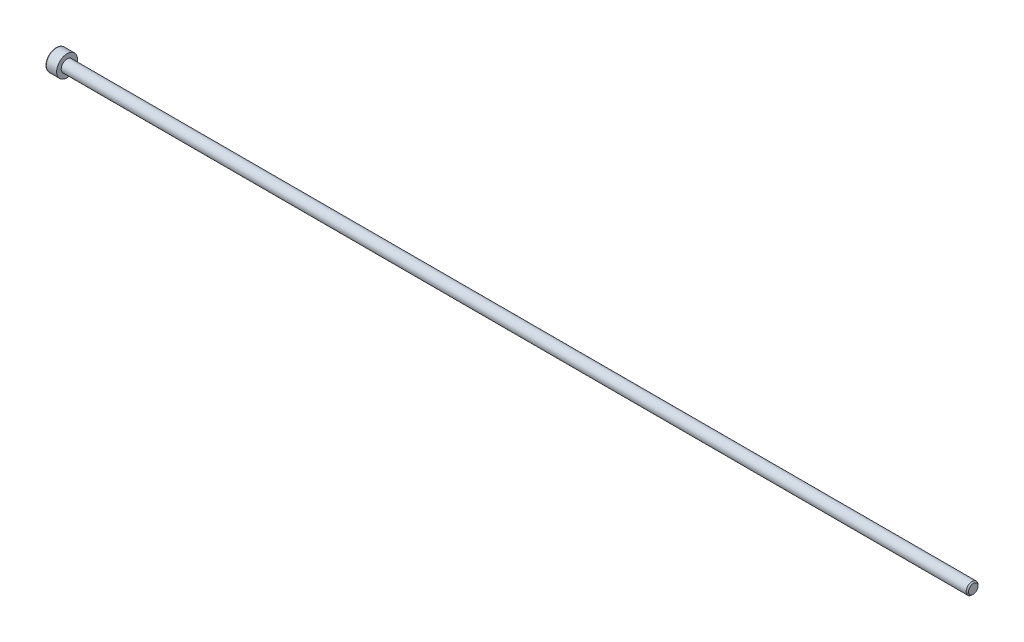
from build123d import *

# Parameters (mm, degrees)
CUT_EXTRUDE1_DEPTH = 1.3
FILLET1_R          = 0.266
CHAMFER2_SIZE      = 0.3065


with BuildPart() as part:
    # Sketch1 → Revolve1 (revolve)
    with BuildSketch(Plane(origin=(0, 0, 0), x_dir=(-1, 0, 0), z_dir=(0, 0, -1)), mode=Mode.PRIVATE) as revolve1_sk:
        Polygon((0, 0), (2.86, 0), (2.86, 2.66), (0, 2.66), (0, 1.5), (-230, 1.5), (-230, 0), align=None)
    revolve(revolve1_sk.sketch.rotate(Axis((0, 0, 0), (-1, 0, 0)), 180), axis=Axis((0, 0, 0), (-1, 0, 0)))

    # Sketch2 → Cut-Extrude1 (cut)
    with BuildSketch(Plane.ZY.offset(2.86)):
        Polygon((-1.25, -0.721687836), (0, -1.443375673), (1.25, -0.721687836), (1.25, 0.721687836), (0, 1.443375673), (-1.25, 0.721687836), align=None)
    extrude(amount=-CUT_EXTRUDE1_DEPTH, mode=Mode.SUBTRACT)

    # Fillet1
    fillet1_edges = [part.edges().sort_by_distance(p)[0] for p in [
        (-2.86, 2.66, 0),
    ]]
    fillet(fillet1_edges, radius=FILLET1_R)

    # Chamfer2
    chamfer2_edges = [part.edges().sort_by_distance(p)[0] for p in [
        (230, 1.5, 0),
    ]]
    chamfer(chamfer2_edges, length=CHAMFER2_SIZE)


solid = part.part
